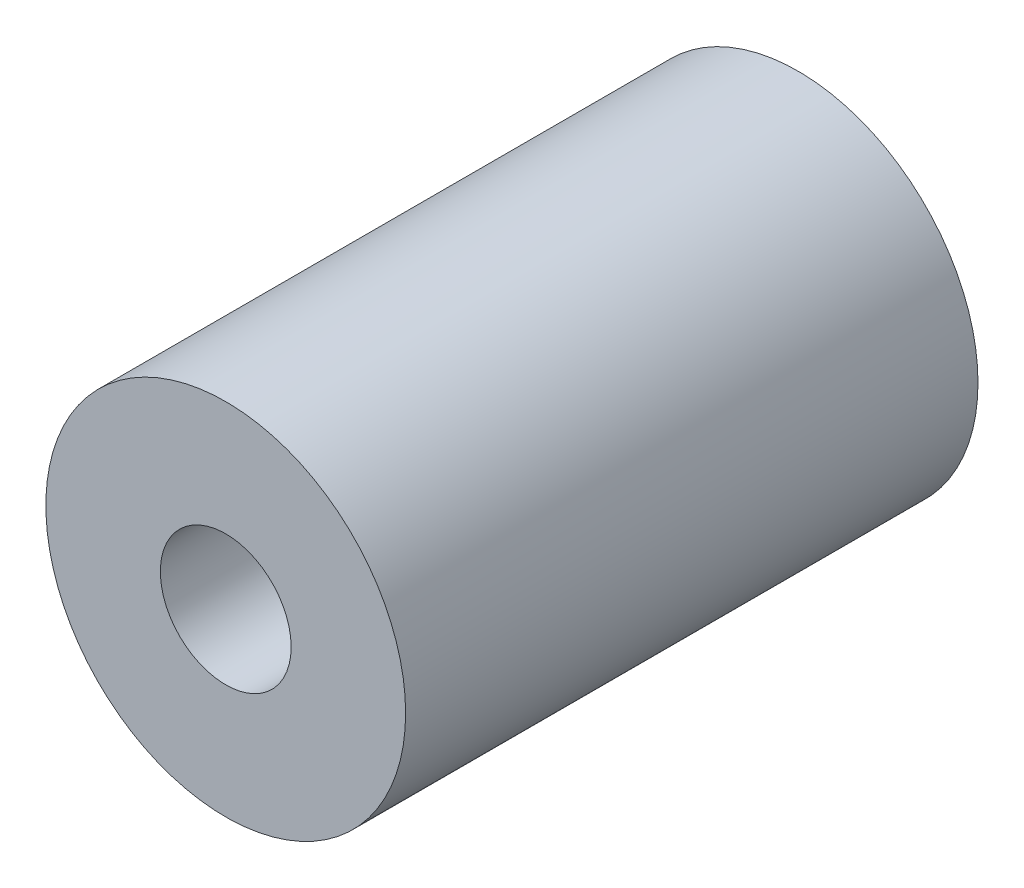
from build123d import *

# Parameters (mm, degrees)
SKETCH_3_R          = 11
EXTRUDE_2_DEPTH     = 35
SKETCH_4_R          = 4
CUT_EXTRUDE_1_DEPTH = 35
SKETCH_5_R          = 2
CUT_EXTRUDE_2_DEPTH = 35


with BuildPart() as part:
    # 草图3 → 凸台-拉伸2 (new body)
    with BuildSketch(Plane.XY):
        Circle(SKETCH_3_R)
    extrude(amount=EXTRUDE_2_DEPTH)

    # 草图4 → 切除-拉伸1 (cut)
    with BuildSketch(Plane.XY.offset(35)):
        Circle(SKETCH_4_R)
    extrude(amount=-CUT_EXTRUDE_1_DEPTH, mode=Mode.SUBTRACT)

    # 草图5 → 切除-拉伸2 (cut)
    with BuildSketch(Plane(origin=(0, 0, 0), x_dir=(1, 0, 0), z_dir=(0, 1, 0))):
        with Locations(Location((0, -6.763631076, 0), (0, 0, 270))):
            Circle(SKETCH_5_R)
        with Locations(Location((0, -28.03443095, 0), (0, 0, 270))):
            Circle(SKETCH_5_R)
    extrude(amount=-CUT_EXTRUDE_2_DEPTH, mode=Mode.SUBTRACT)


solid = part.part
